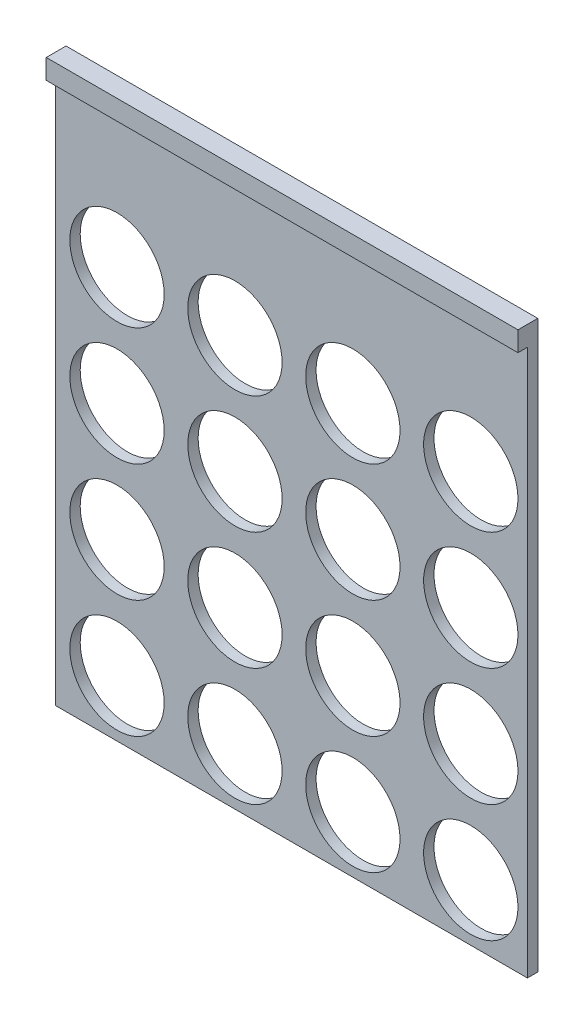
from build123d import *

# Parameters (mm, degrees)
SKETCH1_W           = 100
SKETCH1_H           = 120
BOSS_EXTRUDE1_DEPTH = 2.2
SKETCH2_R           = 10
CUT_EXTRUDE1_DEPTH  = 10
SKETCH3_W           = 100
SKETCH3_H           = 4.205559055
BOSS_EXTRUDE2_DEPTH = 2


with BuildPart() as part:
    # Sketch1 → Boss-Extrude1 (new body)
    with BuildSketch(Plane.XY):
        with Locations((50, 60)):
            Rectangle(SKETCH1_W, SKETCH1_H)
    extrude(amount=BOSS_EXTRUDE1_DEPTH)

    # Sketch2 → Cut-Extrude1 (cut)
    with BuildSketch(Plane.XY.offset(2.2)):
        with Locations((88, 12)):
            Circle(SKETCH2_R)
        with Locations((63, 12)):
            Circle(SKETCH2_R)
        with Locations((38, 12)):
            Circle(SKETCH2_R)
        with Locations((13, 12)):
            Circle(SKETCH2_R)
        with Locations((63, 37)):
            Circle(SKETCH2_R)
        with Locations((38, 37)):
            Circle(SKETCH2_R)
        with Locations((13, 37)):
            Circle(SKETCH2_R)
        with Locations((63, 62)):
            Circle(SKETCH2_R)
        with Locations((38, 62)):
            Circle(SKETCH2_R)
        with Locations((13, 62)):
            Circle(SKETCH2_R)
        with Locations((63, 87)):
            Circle(SKETCH2_R)
        with Locations((38, 87)):
            Circle(SKETCH2_R)
        with Locations((13, 87)):
            Circle(SKETCH2_R)
        with Locations((88, 37)):
            Circle(SKETCH2_R)
        with Locations((88, 62)):
            Circle(SKETCH2_R)
        with Locations((88, 87)):
            Circle(SKETCH2_R)
    extrude(amount=-CUT_EXTRUDE1_DEPTH, mode=Mode.SUBTRACT)

    # Sketch3 → Boss-Extrude2 (add)
    with BuildSketch(Plane.XY.offset(2.2)):
        with Locations((50, 117.897220473)):
            Rectangle(SKETCH3_W, SKETCH3_H)
    extrude(amount=BOSS_EXTRUDE2_DEPTH)


solid = part.part
